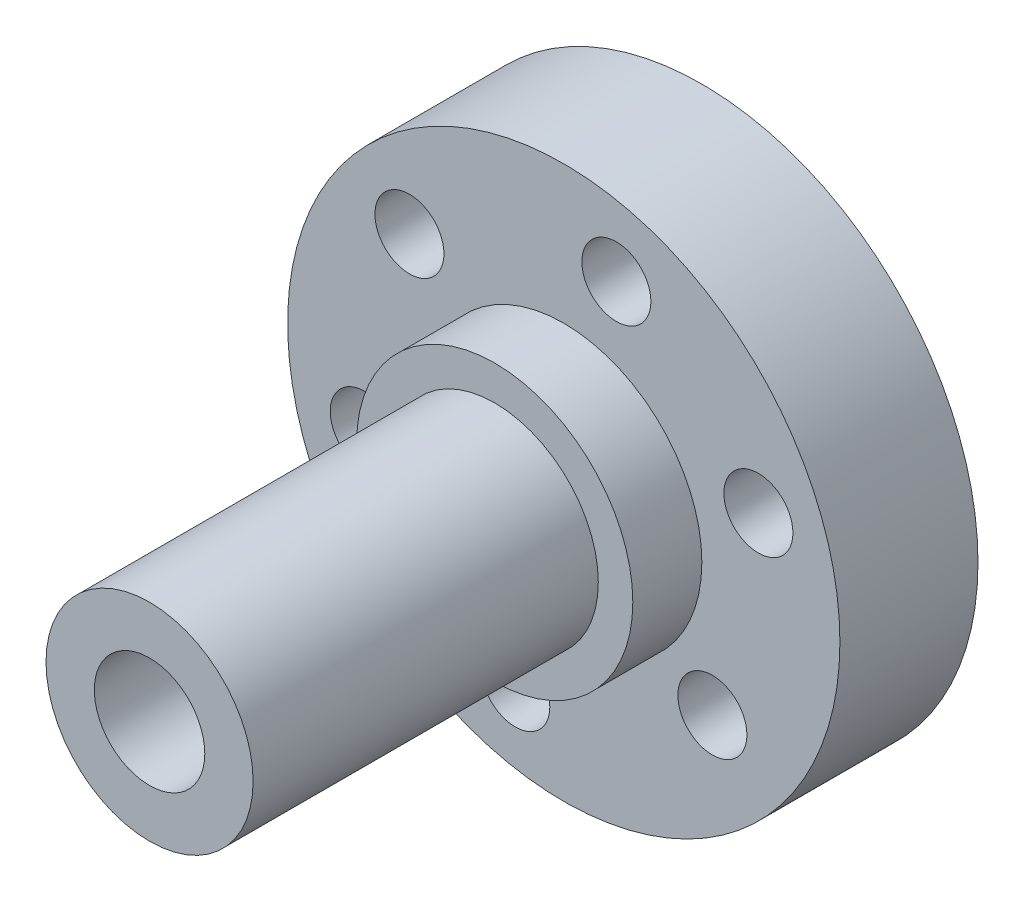
from build123d import *

# Parameters (mm, degrees)
SKETCH1_R           = 20
SKETCH1_R_2         = 2.5
BOSS_EXTRUDE1_DEPTH = 10
SKETCH2_R           = 7.5
BOSS_EXTRUDE2_DEPTH = 30
SKETCH3_R           = 4
CUT_EXTRUDE1_DEPTH  = 30
SKETCH4_W           = 3
SKETCH4_H           = 3
CUT_EXTRUDE2_DEPTH  = 20
SKETCH5_R           = 10
SKETCH5_R_2         = 7.5
BOSS_EXTRUDE3_DEPTH = 5


with BuildPart() as part:
    # Sketch1 → Boss-Extrude1 (new body)
    with BuildSketch(Plane.XY):
        Circle(SKETCH1_R)
        with Locations((3.80920927, 14.508270908)):
            Circle(SKETCH1_R_2, mode=Mode.SUBTRACT)
        with Locations((14.095417524, 5.130224636)):
            Circle(SKETCH1_R_2, mode=Mode.SUBTRACT)
        with Locations((10.763605071, -9.202774002)):
            Circle(SKETCH1_R_2, mode=Mode.SUBTRACT)
        with Locations((-3.511280661, -14.583240659)):
            Circle(SKETCH1_R_2, mode=Mode.SUBTRACT)
        with Locations((-14.415788075, -3.983677546)):
            Circle(SKETCH1_R_2, mode=Mode.SUBTRACT)
        with Locations((-11.178876863, 10.00163547)):
            Circle(SKETCH1_R_2, mode=Mode.SUBTRACT)
    extrude(amount=BOSS_EXTRUDE1_DEPTH)

    # Sketch2 → Boss-Extrude2 (add)
    with BuildSketch(Plane.XY.offset(10)):
        Circle(SKETCH2_R)
    extrude(amount=BOSS_EXTRUDE2_DEPTH)

    # Sketch3 → Cut-Extrude1 (cut)
    with BuildSketch(Plane.XY.offset(40)):
        Circle(SKETCH3_R)
    extrude(amount=-CUT_EXTRUDE1_DEPTH, mode=Mode.SUBTRACT)

    # Sketch4 → Cut-Extrude2 (cut)
    with BuildSketch(Plane(origin=(0, 0, 0), x_dir=(-1, 0, 0), z_dir=(0, 0, -1))):
        Rectangle(SKETCH4_W, SKETCH4_H)
    extrude(amount=-CUT_EXTRUDE2_DEPTH, mode=Mode.SUBTRACT)

    # Sketch5 → Boss-Extrude3 (add)
    with BuildSketch(Plane.XY.offset(10)):
        Circle(SKETCH5_R)
        Circle(SKETCH5_R_2, mode=Mode.SUBTRACT)
    extrude(amount=BOSS_EXTRUDE3_DEPTH)


solid = part.part
